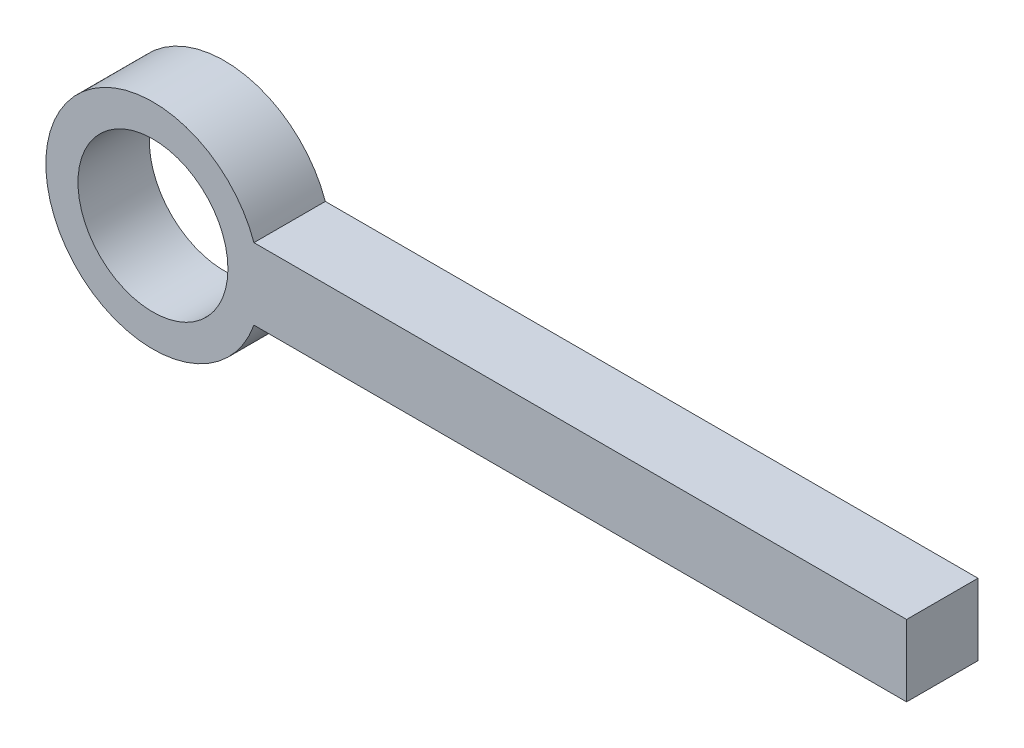
from build123d import *

# Parameters (mm, degrees)
IZIM1_R                     = 10.5
Y_KSEKLIK_EKSTR_ZYON1_DEPTH = 10


with BuildPart() as part:
    # Çizim1 → Yükseklik-Ekstrüzyon1 (new body)
    with BuildSketch(Plane.XY):
        with BuildLine():
            Line((80.295084686, 5), (-11.098302389, 5))
            ThreePointArc((-11.098302389, 5), (-40.240438013, 0), (-11.098302389, -5))
            Line((-11.098302389, -5), (80.295084686, -5))
            Line((80.295084686, -5), (80.295084686, 5))
        make_face()
        with Locations((-25.240438013, 0)):
            Circle(IZIM1_R, mode=Mode.SUBTRACT)
    extrude(amount=Y_KSEKLIK_EKSTR_ZYON1_DEPTH)


solid = part.part
